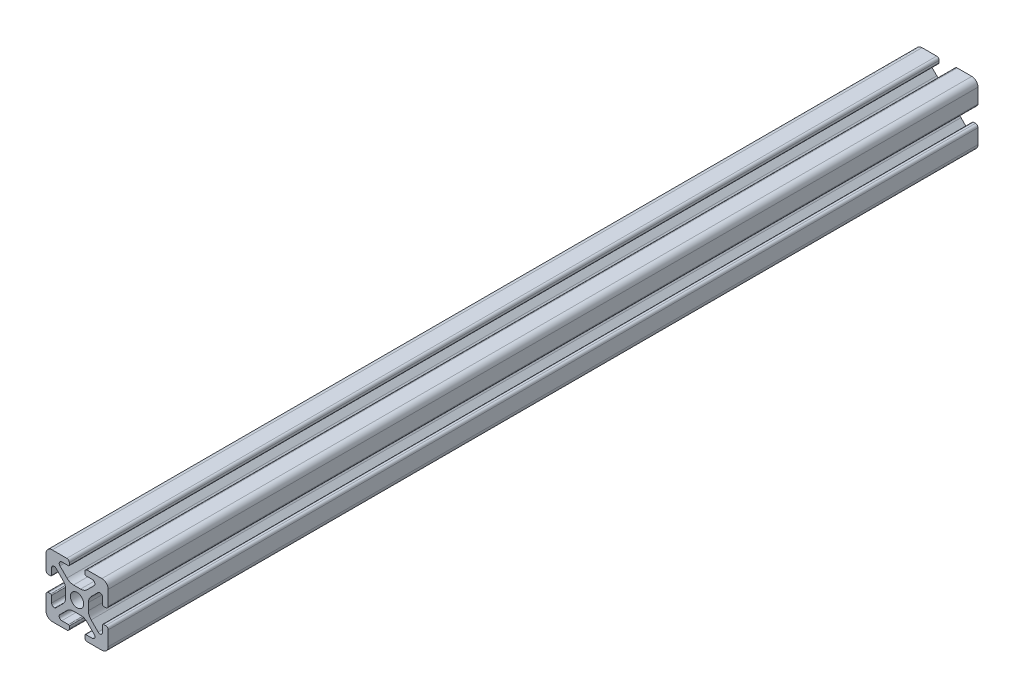
from build123d import *

# Parameters (mm, degrees)
ESQUISSE1_R        = 2.15
BOSS_EXTRU_1_DEPTH = 280


with BuildPart() as part:
    # Esquisse1 → Boss.-Extru.1 (new body)
    with BuildSketch(Plane(origin=(0, 0, 0), x_dir=(-1, 0, 0), z_dir=(0, 0, -1))):
        with BuildLine():
            Line((-20, 6.7), (-20, 2))
            ThreePointArc((-20, 2), (-19.414213562, 0.585786438), (-18, 0))
            Line((-18, 0), (-13.3, 0))
            ThreePointArc((-13.3, 0), (-12.734314575, 0.234314575), (-12.5, 0.8))
            Line((-12.5, 0.8), (-12.5, 1.5))
            ThreePointArc((-12.5, 1.5), (-12.587867966, 1.712132034), (-12.8, 1.8))
            Line((-12.8, 1.8), (-14.918424061, 1.8))
            ThreePointArc((-14.918424061, 1.8), (-15.686700051, 2.313345604), (-15.506437047, 3.219588924))
            Line((-15.506437047, 3.219588924), (-13.254705627, 5.471320344))
            ThreePointArc((-13.254705627, 5.471320344), (-12.281435581, 6.121638598), (-11.133385284, 6.35))
            Line((-11.133385284, 6.35), (-8.866614716, 6.35))
            ThreePointArc((-8.866614716, 6.35), (-7.718564419, 6.121638598), (-6.745294373, 5.471320344))
            Line((-6.745294373, 5.471320344), (-4.493562953, 3.219588924))
            ThreePointArc((-4.493562953, 3.219588924), (-4.313299949, 2.313345604), (-5.081575939, 1.8))
            Line((-5.081575939, 1.8), (-7.2, 1.8))
            ThreePointArc((-7.2, 1.8), (-7.412132034, 1.712132034), (-7.5, 1.5))
            Line((-7.5, 1.5), (-7.5, 0.8))
            ThreePointArc((-7.5, 0.8), (-7.265685425, 0.234314575), (-6.7, 0))
            Line((-6.7, 0), (-2, 0))
            ThreePointArc((-2, 0), (-0.585786438, 0.585786438), (0, 2))
            Line((0, 2), (0, 6.7))
            ThreePointArc((0, 6.7), (-0.234314575, 7.265685425), (-0.8, 7.5))
            Line((-0.8, 7.5), (-1.5, 7.5))
            ThreePointArc((-1.5, 7.5), (-1.712132034, 7.412132034), (-1.8, 7.2))
            Line((-1.8, 7.2), (-1.8, 5.081575939))
            ThreePointArc((-1.8, 5.081575939), (-2.313345604, 4.313299949), (-3.219588924, 4.493562953))
            Line((-3.219588924, 4.493562953), (-5.471320344, 6.745294373))
            ThreePointArc((-5.471320344, 6.745294373), (-6.121638598, 7.718564419), (-6.35, 8.866614716))
            Line((-6.35, 8.866614716), (-6.35, 11.133385284))
            ThreePointArc((-6.35, 11.133385284), (-6.121638598, 12.281435581), (-5.471320344, 13.254705627))
            Line((-5.471320344, 13.254705627), (-3.219588924, 15.506437047))
            ThreePointArc((-3.219588924, 15.506437047), (-2.313345604, 15.686700051), (-1.8, 14.918424061))
            Line((-1.8, 14.918424061), (-1.8, 12.8))
            ThreePointArc((-1.8, 12.8), (-1.712132034, 12.587867966), (-1.5, 12.5))
            Line((-1.5, 12.5), (-0.8, 12.5))
            ThreePointArc((-0.8, 12.5), (-0.234314575, 12.734314575), (0, 13.3))
            Line((0, 13.3), (0, 18))
            ThreePointArc((0, 18), (-0.585786438, 19.414213562), (-2, 20))
            Line((-2, 20), (-6.7, 20))
            ThreePointArc((-6.7, 20), (-7.265685425, 19.765685425), (-7.5, 19.2))
            Line((-7.5, 19.2), (-7.5, 18.5))
            ThreePointArc((-7.5, 18.5), (-7.412132034, 18.287867966), (-7.2, 18.2))
            Line((-7.2, 18.2), (-5.081575939, 18.2))
            ThreePointArc((-5.081575939, 18.2), (-4.313299949, 17.686654396), (-4.493562953, 16.780411076))
            Line((-4.493562953, 16.780411076), (-6.745294373, 14.528679656))
            ThreePointArc((-6.745294373, 14.528679656), (-7.718564419, 13.878361402), (-8.866614716, 13.65))
            Line((-8.866614716, 13.65), (-11.133385284, 13.65))
            ThreePointArc((-11.133385284, 13.65), (-12.281435581, 13.878361402), (-13.254705627, 14.528679656))
            Line((-13.254705627, 14.528679656), (-15.506437047, 16.780411076))
            ThreePointArc((-15.506437047, 16.780411076), (-15.686700051, 17.686654396), (-14.918424061, 18.2))
            Line((-14.918424061, 18.2), (-12.8, 18.2))
            ThreePointArc((-12.8, 18.2), (-12.587867966, 18.287867966), (-12.5, 18.5))
            Line((-12.5, 18.5), (-12.5, 19.2))
            ThreePointArc((-12.5, 19.2), (-12.734314575, 19.765685425), (-13.3, 20))
            Line((-13.3, 20), (-18, 20))
            ThreePointArc((-18, 20), (-19.414213562, 19.414213562), (-20, 18))
            Line((-20, 18), (-20, 13.3))
            ThreePointArc((-20, 13.3), (-19.765685425, 12.734314575), (-19.2, 12.5))
            Line((-19.2, 12.5), (-18.5, 12.5))
            ThreePointArc((-18.5, 12.5), (-18.287867966, 12.587867966), (-18.2, 12.8))
            Line((-18.2, 12.8), (-18.2, 14.918424061))
            ThreePointArc((-18.2, 14.918424061), (-17.686654396, 15.686700051), (-16.780411076, 15.506437047))
            Line((-16.780411076, 15.506437047), (-14.528679656, 13.254705627))
            ThreePointArc((-14.528679656, 13.254705627), (-13.878361402, 12.281435581), (-13.65, 11.133385284))
            Line((-13.65, 11.133385284), (-13.65, 8.866614716))
            ThreePointArc((-13.65, 8.866614716), (-13.878361402, 7.718564419), (-14.528679656, 6.745294373))
            Line((-14.528679656, 6.745294373), (-16.780411076, 4.493562953))
            ThreePointArc((-16.780411076, 4.493562953), (-17.686654396, 4.313299949), (-18.2, 5.081575939))
            Line((-18.2, 5.081575939), (-18.2, 7.2))
            ThreePointArc((-18.2, 7.2), (-18.287867966, 7.412132034), (-18.5, 7.5))
            Line((-18.5, 7.5), (-19.2, 7.5))
            ThreePointArc((-19.2, 7.5), (-19.765685425, 7.265685425), (-20, 6.7))
        make_face()
        with Locations(Location((-10, 10, 0), (0, 0, 180))):
            Circle(ESQUISSE1_R, mode=Mode.SUBTRACT)
    extrude(amount=-BOSS_EXTRU_1_DEPTH)


solid = part.part
